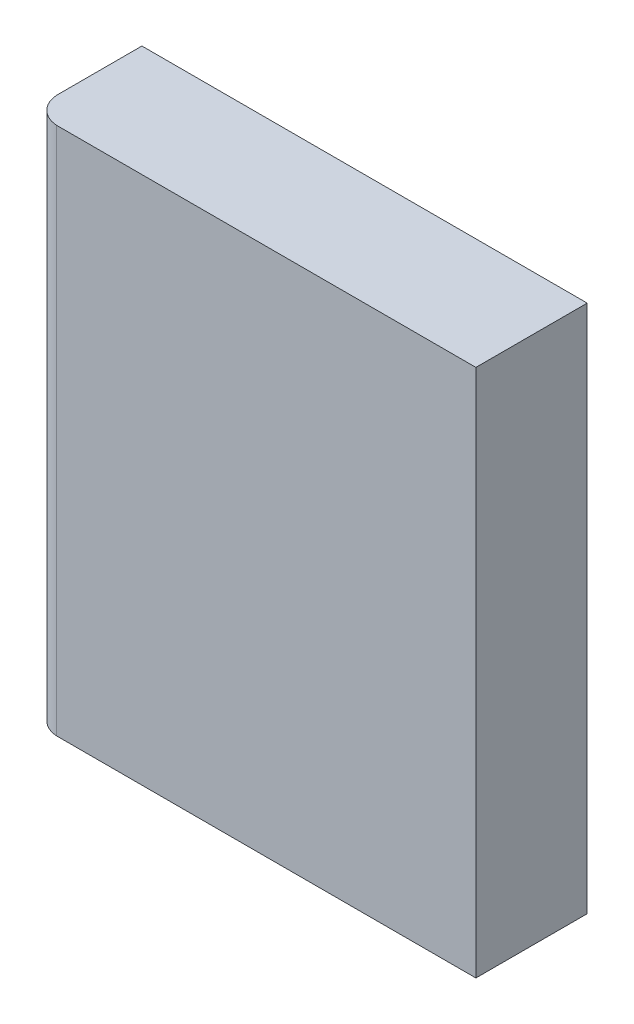
from build123d import *

# Parameters (mm, degrees)
BOSS_EXTRUDE1_DEPTH = 30.1625


with BuildPart() as part:
    # Sketch1 → Boss-Extrude1 (new body)
    with BuildSketch(Plane(origin=(0, 0, 0), x_dir=(1, 0, 0), z_dir=(0, 1, 0))):
        with BuildLine():
            Line((-12.763323234, 2.922811354), (12.636676766, 2.922811354))
            Line((12.636676766, 2.922811354), (12.636676766, -3.427188646))
            Line((12.636676766, -3.427188646), (-11.280378702, -3.427188646))
            ThreePointArc((-11.280378702, -3.427188646), (-12.306608047, -2.959531666), (-12.763323234, -1.928386208))
            Line((-12.763323234, -1.928386208), (-12.763323234, 2.922811354))
        make_face()
    extrude(amount=BOSS_EXTRUDE1_DEPTH)


solid = part.part
